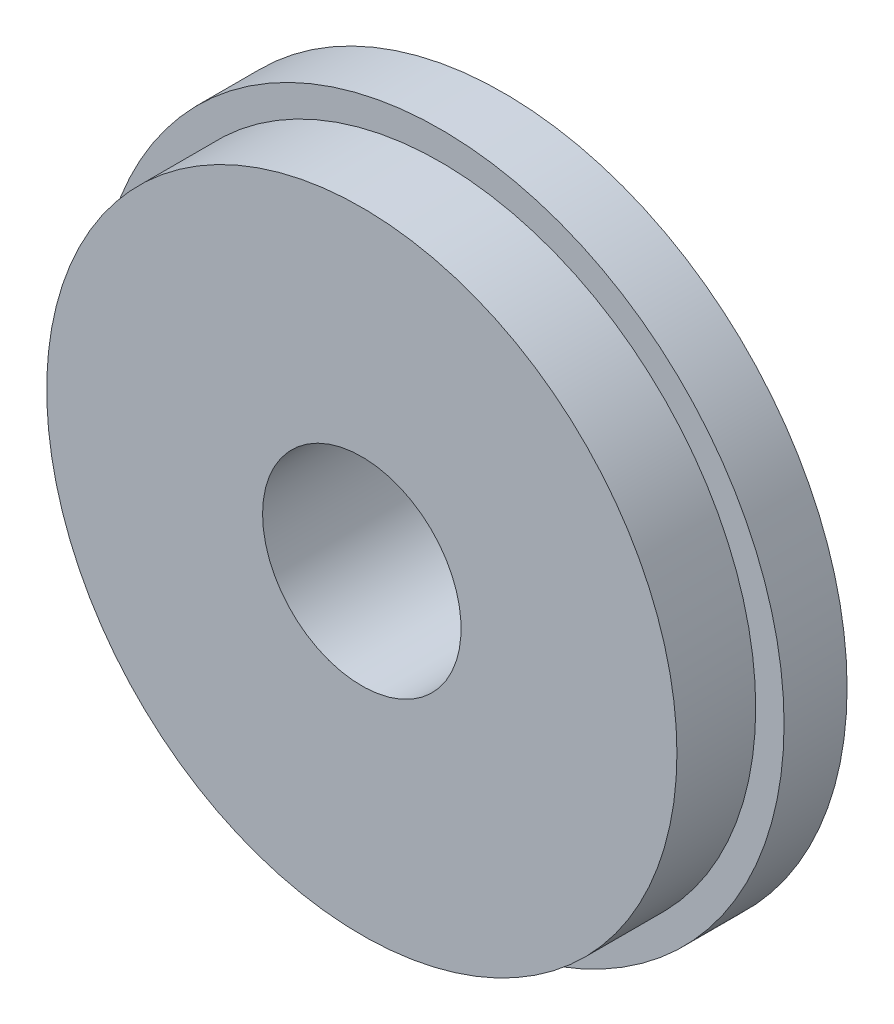
from build123d import *

# Parameters (mm, degrees)
SKETCH1_R           = 10.9
BOSS_EXTRUDE1_DEPTH = 2
SKETCH2_R           = 10
BOSS_EXTRUDE2_DEPTH = 2.5
SKETCH3_R           = 3.15
CUT_EXTRUDE1_DEPTH  = 17.058331171


with BuildPart() as part:
    # Sketch1 → Boss-Extrude1 (new body)
    with BuildSketch(Plane.XY):
        Circle(SKETCH1_R)
    extrude(amount=BOSS_EXTRUDE1_DEPTH)

    # Sketch2 → Boss-Extrude2 (add)
    with BuildSketch(Plane.XY.offset(2)):
        Circle(SKETCH2_R)
    extrude(amount=BOSS_EXTRUDE2_DEPTH)

    # Sketch3 → Cut-Extrude1 (cut, through all)
    with BuildSketch(Plane(origin=(0, 0, 0), x_dir=(-1, 0, 0), z_dir=(0, 0, -1))):
        Circle(SKETCH3_R)
    extrude(amount=-CUT_EXTRUDE1_DEPTH, mode=Mode.SUBTRACT)


solid = part.part
